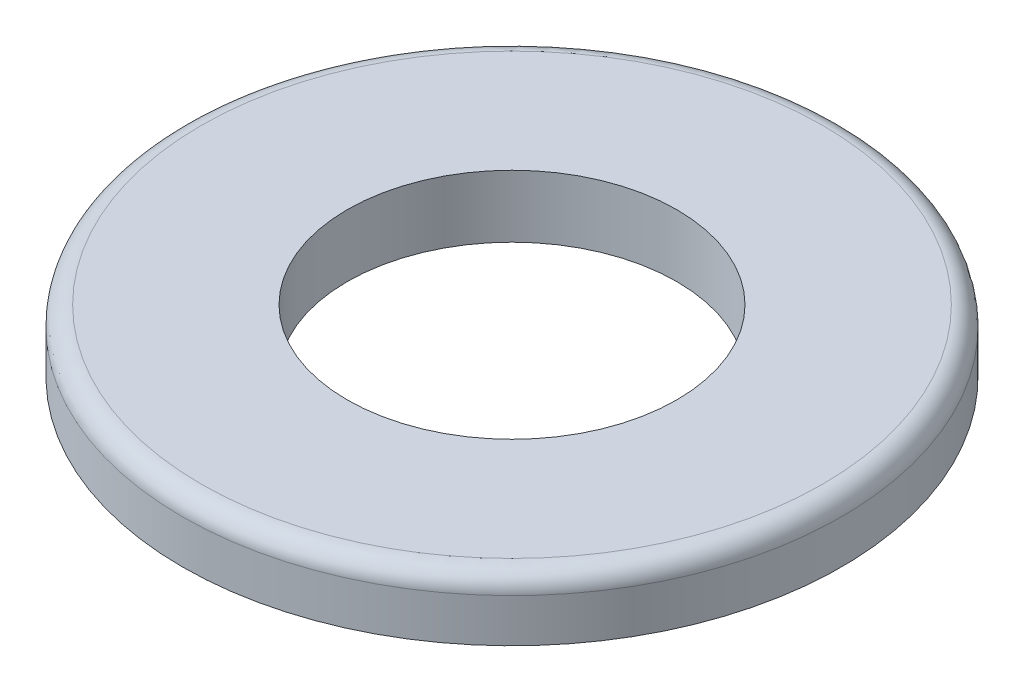
from build123d import *

# Parameters (mm, degrees)
SKETCH1_R           = 8.73125
SKETCH1_R_2         = 4.365625
BOSS_EXTRUDE1_DEPTH = 1.651
FILLET1_R           = 0.5


with BuildPart() as part:
    # Sketch1 → Boss-Extrude1 (new body)
    with BuildSketch(Plane(origin=(0, 0, 0), x_dir=(1, 0, 0), z_dir=(0, 1, 0))):
        with Locations(Location((0, 0, 0), (0, 0, 90))):
            Circle(SKETCH1_R)
        with Locations(Location((0, 0, 0), (0, 0, 90))):
            Circle(SKETCH1_R_2, mode=Mode.SUBTRACT)
    extrude(amount=BOSS_EXTRUDE1_DEPTH)

    # Fillet1
    fillet1_edges = [part.edges().sort_by_distance(p)[0] for p in [
        (0, 1.651, 8.73125),
    ]]
    fillet(fillet1_edges, radius=FILLET1_R)


solid = part.part
